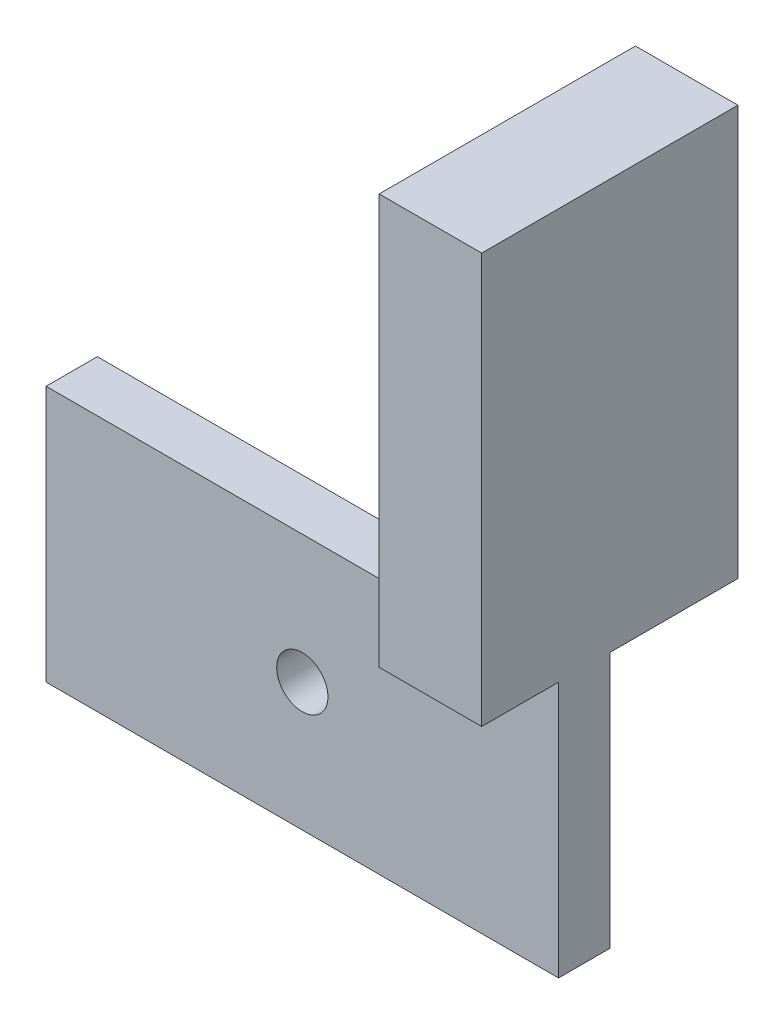
from build123d import *

# Parameters (mm, degrees)
SKETCH_1_W          = 1000
SKETCH_1_H          = 500
EXTRUDE_1_DEPTH     = 100
SKETCH_2_W          = 200
SKETCH_2_H          = 500
EXTRUDE_2_DEPTH     = 800
SKETCH_3_R          = 50
CUT_EXTRUDE_1_DEPTH = 1190.537725337


with BuildPart() as part:
    # 草图1 → 凸台-拉伸1 (new body)
    with BuildSketch(Plane.XY):
        Rectangle(SKETCH_1_W, SKETCH_1_H)
    extrude(amount=EXTRUDE_1_DEPTH)

    # 草图2 → 凸台-拉伸2 (add)
    with BuildSketch(Plane(origin=(0, 250, 0), x_dir=(1, 0, 0), z_dir=(0, 1, 0))):
        with Locations((400, 0)):
            Rectangle(SKETCH_2_W, SKETCH_2_H)
    extrude(amount=EXTRUDE_2_DEPTH)

    # 草图3 → 切除-拉伸1 (cut, through all)
    with BuildSketch(Plane.XY):
        with Locations(Location((0, 0, 0), (0, 0, 180))):
            Circle(SKETCH_3_R)
    extrude(amount=CUT_EXTRUDE_1_DEPTH, mode=Mode.SUBTRACT)


solid = part.part
